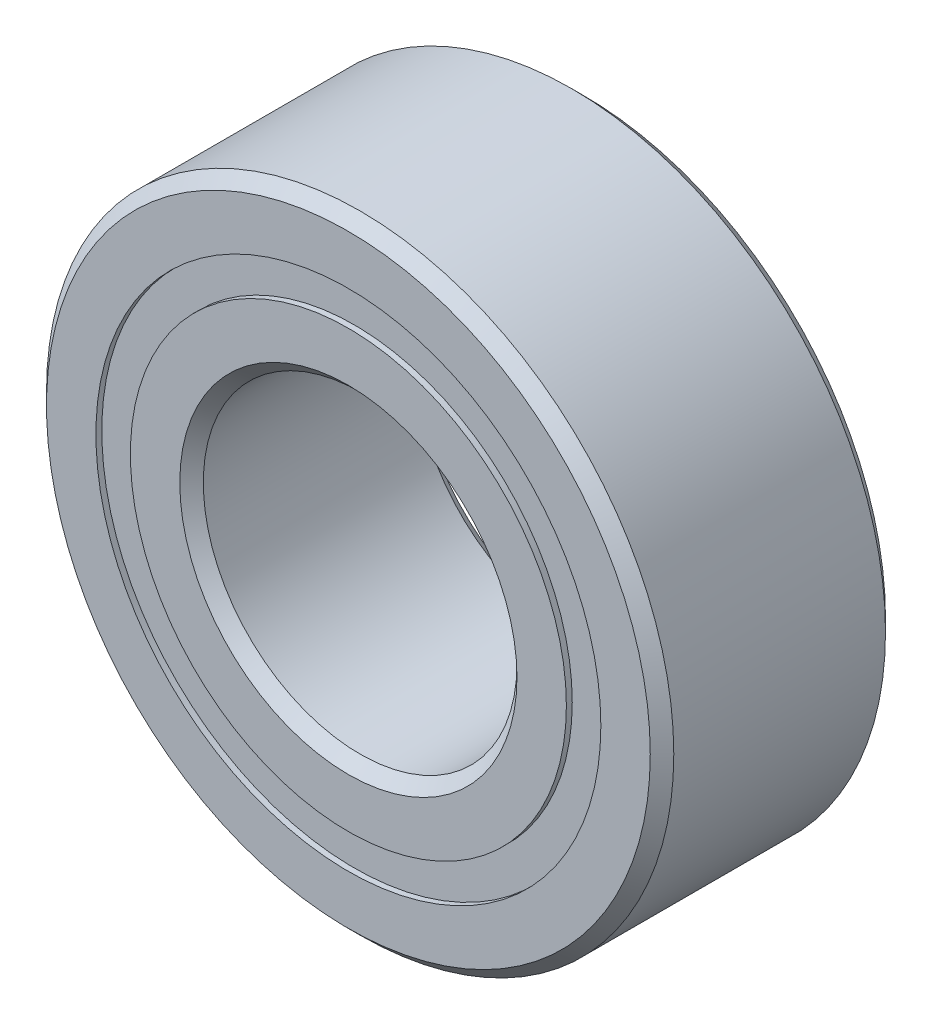
from build123d import *

# Parameters (mm, degrees)
CIRPATTERN1_COUNT = 12
SKETCH5_W         = 1.147826059
SKETCH5_H         = 0.697802198


with BuildPart() as part:
    # Sketch1 → Revolve1 (revolve)
    with BuildSketch(Plane(origin=(0, 0, 0), x_dir=(0, 0, -1), z_dir=(1, 0, 0)), mode=Mode.PRIVATE) as revolve1_sk:
        with BuildLine():
            Line((2.143125, 6.35), (-2.143125, 6.35))
            Line((-2.143125, 6.35), (-2.38125, 6.111875))
            Line((-2.38125, 6.111875), (-2.38125, 5.111401099))
            Line((-2.38125, 5.111401099), (-1.058333333, 5.111401099))
            ThreePointArc((-1.058333333, 5.111401099), (0, 5.876861441), (1.058333333, 5.111401099))
            Line((1.058333333, 5.111401099), (2.38125, 5.111401099))
            Line((2.38125, 5.111401099), (2.38125, 6.111875))
            Line((2.38125, 6.111875), (2.143125, 6.35))
        make_face()
    revolve(revolve1_sk.sketch.rotate(Axis((0, 0, 2.38125), (0, 0, -1)), 90), axis=Axis((0, 0, 2.38125), (0, 0, -1)))


with BuildPart() as body_2:
    # Sketch3 → Revolve3 (revolve)
    with BuildSketch(Plane(origin=(0, 0, 0), x_dir=(0, 0, -1), z_dir=(1, 0, 0)), mode=Mode.PRIVATE) as revolve3_sk:
        with BuildLine():
            Line((-1.058333333, 4.413598901), (-2.38125, 4.413598901))
            Line((-2.38125, 4.413598901), (-2.38125, 3.413125))
            Line((-2.38125, 3.413125), (-2.143125, 3.175))
            Line((-2.143125, 3.175), (2.143125, 3.175))
            Line((2.143125, 3.175), (2.38125, 3.413125))
            Line((2.38125, 3.413125), (2.38125, 4.413598901))
            Line((2.38125, 4.413598901), (1.058333333, 4.413598901))
            ThreePointArc((1.058333333, 4.413598901), (0, 3.648138559), (-1.058333333, 4.413598901))
        make_face()
    revolve(revolve3_sk.sketch.rotate(Axis((0, 0, 2.38125), (0, 0, -1)), 90), axis=Axis((0, 0, 2.38125), (0, 0, -1)))


with BuildPart() as body_3:
    # Sketch4 → Revolve4 (revolve)
    with BuildSketch(Plane(origin=(0, 0, 0), x_dir=(0, 0, -1), z_dir=(1, 0, 0))):
        with BuildLine():
            Line((-1.114361441, 4.7625), (1.114361441, 4.7625))
            ThreePointArc((1.114361441, 4.7625), (0, 5.876861441), (-1.114361441, 4.7625))
        make_face()
    revolve(axis=Axis((0, 4.7625, 1.114361441), (0, 0, -1)))


with BuildPart() as cirpattern1_1:
    # CirPattern1: pattern copy
    add(body_3.part.rotate(Axis((0, 0, 0), (0, 0, 1)), 1 * 360 / CIRPATTERN1_COUNT))


with BuildPart() as cirpattern1_2:
    # CirPattern1: pattern copy
    add(body_3.part.rotate(Axis((0, 0, 0), (0, 0, 1)), 2 * 360 / CIRPATTERN1_COUNT))


with BuildPart() as cirpattern1_3:
    # CirPattern1: pattern copy
    add(body_3.part.rotate(Axis((0, 0, 0), (0, 0, 1)), 3 * 360 / CIRPATTERN1_COUNT))


with BuildPart() as cirpattern1_4:
    # CirPattern1: pattern copy
    add(body_3.part.rotate(Axis((0, 0, 0), (0, 0, 1)), 4 * 360 / CIRPATTERN1_COUNT))


with BuildPart() as cirpattern1_5:
    # CirPattern1: pattern copy
    add(body_3.part.rotate(Axis((0, 0, 0), (0, 0, 1)), 5 * 360 / CIRPATTERN1_COUNT))


with BuildPart() as cirpattern1_6:
    # CirPattern1: pattern copy
    add(body_3.part.rotate(Axis((0, 0, 0), (0, 0, 1)), 6 * 360 / CIRPATTERN1_COUNT))


with BuildPart() as cirpattern1_7:
    # CirPattern1: pattern copy
    add(body_3.part.rotate(Axis((0, 0, 0), (0, 0, 1)), 7 * 360 / CIRPATTERN1_COUNT))


with BuildPart() as cirpattern1_8:
    # CirPattern1: pattern copy
    add(body_3.part.rotate(Axis((0, 0, 0), (0, 0, 1)), 8 * 360 / CIRPATTERN1_COUNT))


with BuildPart() as cirpattern1_9:
    # CirPattern1: pattern copy
    add(body_3.part.rotate(Axis((0, 0, 0), (0, 0, 1)), 9 * 360 / CIRPATTERN1_COUNT))


with BuildPart() as cirpattern1_10:
    # CirPattern1: pattern copy
    add(body_3.part.rotate(Axis((0, 0, 0), (0, 0, 1)), 10 * 360 / CIRPATTERN1_COUNT))


with BuildPart() as cirpattern1_11:
    # CirPattern1: pattern copy
    add(body_3.part.rotate(Axis((0, 0, 0), (0, 0, 1)), 11 * 360 / CIRPATTERN1_COUNT))


with BuildPart() as body_15:
    # Sketch5 → Revolve5 (revolve)
    with BuildSketch(Plane(origin=(0, 0, 0), x_dir=(0, 0, -1), z_dir=(1, 0, 0)), mode=Mode.PRIVATE) as revolve5_sk:
        with Locations((-1.688274471, 4.7625)):
            Rectangle(SKETCH5_W, SKETCH5_H)
        with Locations((1.688274471, 4.7625)):
            Rectangle(SKETCH5_W, SKETCH5_H)
    revolve(revolve5_sk.sketch.rotate(Axis((0, 0, 2.38125), (0, 0, -1)), 90), axis=Axis((0, 0, 2.38125), (0, 0, -1)))


solid = Compound([part.part, body_2.part, body_3.part, cirpattern1_1.part, cirpattern1_2.part, cirpattern1_3.part, cirpattern1_4.part, cirpattern1_5.part, cirpattern1_6.part, cirpattern1_7.part, cirpattern1_8.part, cirpattern1_9.part, cirpattern1_10.part, cirpattern1_11.part, body_15.part])
